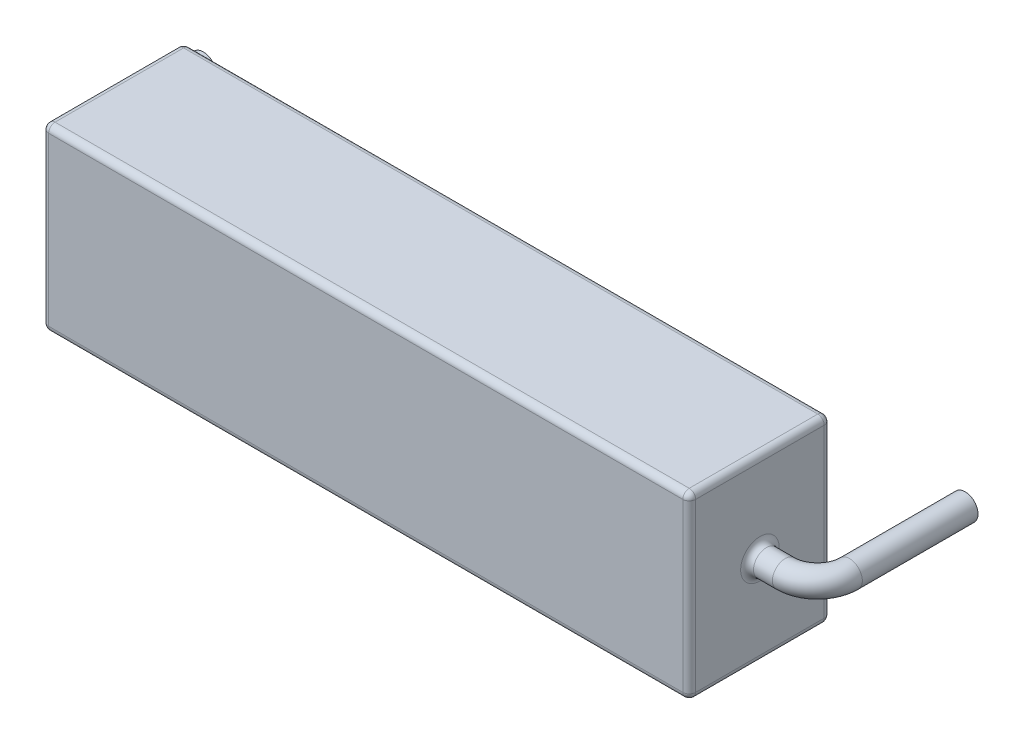
from build123d import *

# Parameters (mm, degrees)
SKETCH1_W           = 15.1
SKETCH1_H           = 4.2
BOSS_EXTRUDE1_DEPTH = 3.3
SKETCH5_R           = 0.3
FILLET1_R           = 0.15


with BuildPart() as part:
    # Sketch1 → Boss-Extrude1 (new body)
    with BuildSketch(Plane.XY):
        with Locations((7.55, 2.1)):
            Rectangle(SKETCH1_W, SKETCH1_H)
    extrude(amount=BOSS_EXTRUDE1_DEPTH)

    # Sweep3: sweep along a path in Sketch2
    with BuildLine(Plane(origin=(0, 2.1, 0), x_dir=(1, 0, 0), z_dir=(0, 1, 0))) as sweep3_path:
        Line((16.44, 1.8), (16.44, -0.9))
        ThreePointArc((16.44, -0.9), (16.220330086, -1.430330086), (15.69, -1.65))
        Line((15.69, -1.65), (15.1, -1.65))
        Line((15.1, -1.65), (0, -1.65))
        Line((0, -1.65), (-0.59, -1.65))
        ThreePointArc((-0.59, -1.65), (-1.120330086, -1.430330086), (-1.34, -0.9))
        Line((-1.34, -0.9), (-1.34, 1.8))
    # Sketch5 → Sweep3 (sweep)
    with BuildSketch(Plane.XY.offset(-1.8)):
        with Locations((-1.34, 2.1)):
            Circle(SKETCH5_R)
    sweep(path=sweep3_path.line)

    # Fillet1
    fillet1_edges = [part.edges().sort_by_distance(p)[0] for p in [
        (15.1, 2.1, 3.3),
        (7.55, 4.2, 3.3),
        (0, 2.1, 1.95),
        (15.1, 2.1, 1.95),
        (0, 2.1, 3.3),
        (7.55, 4.2, 0),
        (15.1, 2.1, 0),
        (7.55, 0, 0),
        (0, 2.1, 0),
        (7.55, 0, 3.3),
        (0, 4.2, 1.65),
        (15.1, 4.2, 1.65),
        (15.1, 0, 1.65),
        (0, 0, 1.65),
    ]]
    fillet(fillet1_edges, radius=FILLET1_R)


solid = part.part
